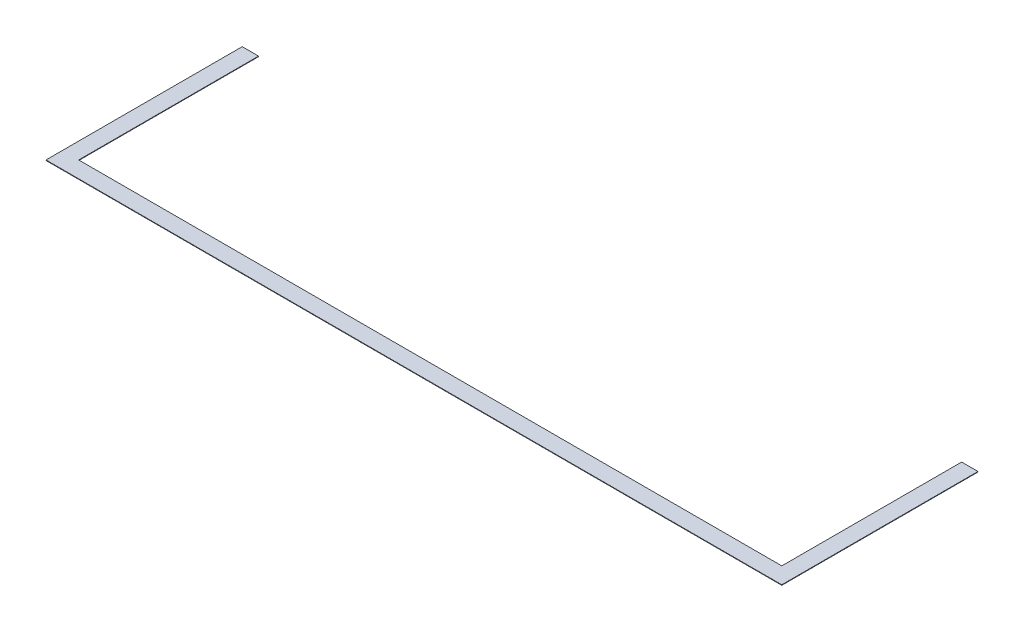
from build123d import *

# Parameters (mm, degrees)
BOSS_EXTRUDE1_DEPTH = 1.5875


with BuildPart() as part:
    # Sketch1 → Boss-Extrude1 (new body)
    with BuildSketch(Plane(origin=(0, 0, 0), x_dir=(1, 0, 0), z_dir=(0, 1, 0))):
        Polygon((50.8, 0), (0, 0), (0, -609.6), (50.8, -609.6), (50.8, -558.8), align=None)
        Polygon((50.8, -558.8), (50.8, -609.6), (2286, -609.6), (2286, 0), (2235.2, 0), (2235.2, -558.8), align=None)
    extrude(amount=BOSS_EXTRUDE1_DEPTH)


solid = part.part
